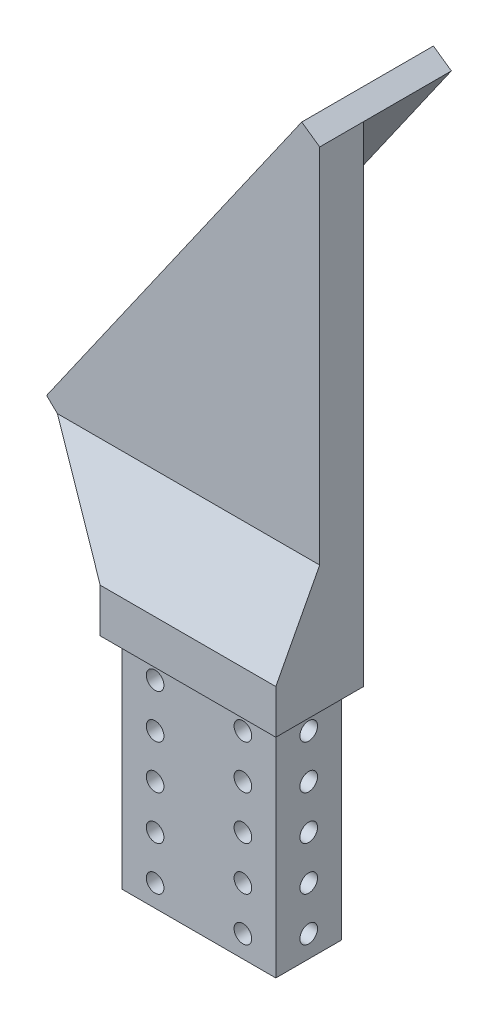
from build123d import *

# Parameters (mm, degrees)
BOSS_EXTRUDE1_DEPTH = 25.4
SKETCH3_W           = 50.8
SKETCH3_H           = 63.5
CUT_EXTRUDE1_DEPTH  = 3.175
SKETCH4_W           = 25.4
SKETCH4_H           = 63.5
CUT_EXTRUDE2_DEPTH  = 3.175
SKETCH5_W           = 50.8
SKETCH5_H           = 63.5
CUT_EXTRUDE3_DEPTH  = 3.175
SKETCH6_W           = 25.4
SKETCH6_H           = 63.5
CUT_EXTRUDE4_DEPTH  = 3.175
SKETCH7_W           = 101.6
SKETCH7_H           = 177.8
CUT_EXTRUDE5_DEPTH  = 298.299377732
CUT_EXTRUDE7_DEPTH  = 275.74300719
CUT_EXTRUDE6_DEPTH  = 275.74300719
CUT_EXTRUDE8_DEPTH  = 271.614582269
SKETCH11_R          = 2.5527
CUT_EXTRUDE9_DEPTH  = 259.040032264
SKETCH12_R          = 2.5527
CUT_EXTRUDE10_DEPTH = 260.254504648
BOSS_EXTRUDE2_DEPTH = 25.4
CUT_EXTRUDE11_DEPTH = 263.236499242
CUT_EXTRUDE12_DEPTH = 263.052184929
CUT_EXTRUDE13_DEPTH = 266.160848634
CUT_EXTRUDE14_DEPTH = 261.679987062
CUT_EXTRUDE15_DEPTH = 250.010650693


with BuildPart() as part:
    # Sketch1 → Boss-Extrude1 (new body)
    with BuildSketch(Plane.XY):
        Polygon((50.8, 76.2), (152.4, 76.2), (152.4, 254), (-101.6, 254), (-101.6, 76.2), (0, 76.2), (0, 0), (50.8, 0), align=None)
    extrude(amount=BOSS_EXTRUDE1_DEPTH)

    # Sketch3 → Cut-Extrude1 (cut)
    with BuildSketch(Plane.XY.offset(25.4)):
        with Locations((25.4, 31.75)):
            Rectangle(SKETCH3_W, SKETCH3_H)
    extrude(amount=-CUT_EXTRUDE1_DEPTH, mode=Mode.SUBTRACT)

    # Sketch4 → Cut-Extrude2 (cut)
    with BuildSketch(Plane.ZY):
        with Locations((12.7, 31.75)):
            Rectangle(SKETCH4_W, SKETCH4_H)
    extrude(amount=-CUT_EXTRUDE2_DEPTH, mode=Mode.SUBTRACT)

    # Sketch5 → Cut-Extrude3 (cut)
    with BuildSketch(Plane(origin=(0, 0, 0), x_dir=(-1, 0, 0), z_dir=(0, 0, -1))):
        with Locations((-25.4, 31.75)):
            Rectangle(SKETCH5_W, SKETCH5_H)
    extrude(amount=-CUT_EXTRUDE3_DEPTH, mode=Mode.SUBTRACT)

    # Sketch6 → Cut-Extrude4 (cut)
    with BuildSketch(Plane(origin=(50.8, 0, 0), x_dir=(0, 0, -1), z_dir=(1, 0, 0))):
        with Locations((-12.7, 31.75)):
            Rectangle(SKETCH6_W, SKETCH6_H)
    extrude(amount=-CUT_EXTRUDE4_DEPTH, mode=Mode.SUBTRACT)

    # Sketch7 → Cut-Extrude5 (cut, through all)
    with BuildSketch(Plane.XY.offset(25.4)):
        with Locations((101.6, 165.1)):
            Rectangle(SKETCH7_W, SKETCH7_H)
    extrude(amount=-CUT_EXTRUDE5_DEPTH, mode=Mode.SUBTRACT)

    # Sketch9 → Cut-Extrude7 (cut, through all)
    with BuildSketch(Plane.XY.offset(25.4)):
        Polygon((34.65764308, 254), (50.8, 254), (50.8, 242.697), align=None)
    extrude(amount=-CUT_EXTRUDE7_DEPTH, mode=Mode.SUBTRACT)

    # Sketch8 → Cut-Extrude6 (cut, through all)
    with BuildSketch(Plane.XY.offset(25.4)):
        Polygon((34.65764308, 254), (-101.6, 59.403918632), (-101.6, 254), align=None)
    extrude(amount=-CUT_EXTRUDE6_DEPTH, mode=Mode.SUBTRACT)

    # Sketch10 → Cut-Extrude8 (cut, through all)
    with BuildSketch(Plane.XY.offset(25.4)):
        Polygon((34.65764308, 254), (45.59768076, 246.339703148), (-84.029822158, 61.212443237), (-94.969859838, 68.872740089), align=None)
    extrude(amount=-CUT_EXTRUDE8_DEPTH, mode=Mode.SUBTRACT)

    # Sketch11 → Cut-Extrude9 (cut, through all)
    with BuildSketch(Plane.XY.offset(22.225)):
        with Locations((12.7, 57.15)):
            Circle(SKETCH11_R)
        with Locations((12.7, 44.45)):
            Circle(SKETCH11_R)
        with Locations((12.7, 31.75)):
            Circle(SKETCH11_R)
        with Locations((12.7, 19.05)):
            Circle(SKETCH11_R)
        with Locations((12.7, 6.35)):
            Circle(SKETCH11_R)
        with Locations((38.1, 44.45)):
            Circle(SKETCH11_R)
        with Locations((38.1, 31.75)):
            Circle(SKETCH11_R)
        with Locations((38.1, 19.05)):
            Circle(SKETCH11_R)
        with Locations((38.1, 6.35)):
            Circle(SKETCH11_R)
        with Locations((38.1, 57.15)):
            Circle(SKETCH11_R)
    extrude(amount=-CUT_EXTRUDE9_DEPTH, mode=Mode.SUBTRACT)

    # Sketch12 → Cut-Extrude10 (cut, through all)
    with BuildSketch(Plane.ZY.offset(-3.175)):
        with Locations(Location((12.7, 57.15, 0), (0, 0, 270))):
            Circle(SKETCH12_R)
        with Locations(Location((12.7, 44.45, 0), (0, 0, 270))):
            Circle(SKETCH12_R)
        with Locations(Location((12.7, 31.75, 0), (0, 0, 270))):
            Circle(SKETCH12_R)
        with Locations(Location((12.7, 19.05, 0), (0, 0, 270))):
            Circle(SKETCH12_R)
        with Locations(Location((12.7, 6.35, 0), (0, 0, 270))):
            Circle(SKETCH12_R)
    extrude(amount=-CUT_EXTRUDE10_DEPTH, mode=Mode.SUBTRACT)

    # Sketch17 → Boss-Extrude2 (add)
    with BuildSketch(Plane(origin=(0, 0, 0), x_dir=(-1, 0, 0), z_dir=(0, 0, -1))):
        Polygon((-45.59768076, 246.339703148), (-68.484788877, 230.313977516), (51.302461146, 59.240055162), (74.189569264, 75.265780794), align=None)
    extrude(amount=BOSS_EXTRUDE2_DEPTH)

    # Sketch18 → Cut-Extrude11 (cut, through all)
    with BuildSketch(Plane(origin=(0, 0, -25.4), x_dir=(-1, 0, 0), z_dir=(0, 0, -1))):
        Polygon((39.426979923, 76.2), (73.535421933, 76.2), (74.189569264, 75.265780794), (51.302461146, 59.240055162), align=None)
    extrude(amount=-CUT_EXTRUDE11_DEPTH, mode=Mode.SUBTRACT)

    # Sketch19 → Cut-Extrude12 (cut, through all)
    with BuildSketch(Plane.XY.offset(25.4)):
        Polygon((0, 76.2), (-43.972708631, 118.419930077), (-73.535421933, 76.2), align=None)
    extrude(amount=-CUT_EXTRUDE12_DEPTH, mode=Mode.SUBTRACT)

    # Sketch20 → Cut-Extrude13 (cut, through all)
    with BuildSketch(Plane(origin=(50.8, 0, 0), x_dir=(0, 0, -1), z_dir=(1, 0, 0))):
        Polygon((-25.4, 76.2), (-12.7, 100.289703148), (-12.7, 246.339703148), (-25.4, 246.339703148), align=None)
    extrude(amount=-CUT_EXTRUDE13_DEPTH, mode=Mode.SUBTRACT)

    # Sketch21 → Cut-Extrude14 (cut, through all)
    with BuildSketch(Plane(origin=(0, 0, -25.4), x_dir=(-1, 0, 0), z_dir=(0, 0, -1))):
        Polygon((-45.59768076, 246.339703148), (-63.283173396, 233.956187887), (28.212035852, 103.287487173), (45.897528488, 115.671002434), align=None)
    extrude(amount=-CUT_EXTRUDE14_DEPTH, mode=Mode.SUBTRACT)

    # Sketch22 → Cut-Extrude15 (cut, through all)
    with BuildSketch(Plane(origin=(0, 0, -25.4), x_dir=(-1, 0, 0), z_dir=(0, 0, -1))):
        Polygon((-50.8, 205.057481532), (-45.597680844, 208.698686951), (-63.283173396, 233.956187887), (-68.484788877, 230.313977516), align=None)
    extrude(amount=-CUT_EXTRUDE15_DEPTH, mode=Mode.SUBTRACT)


solid = part.part
